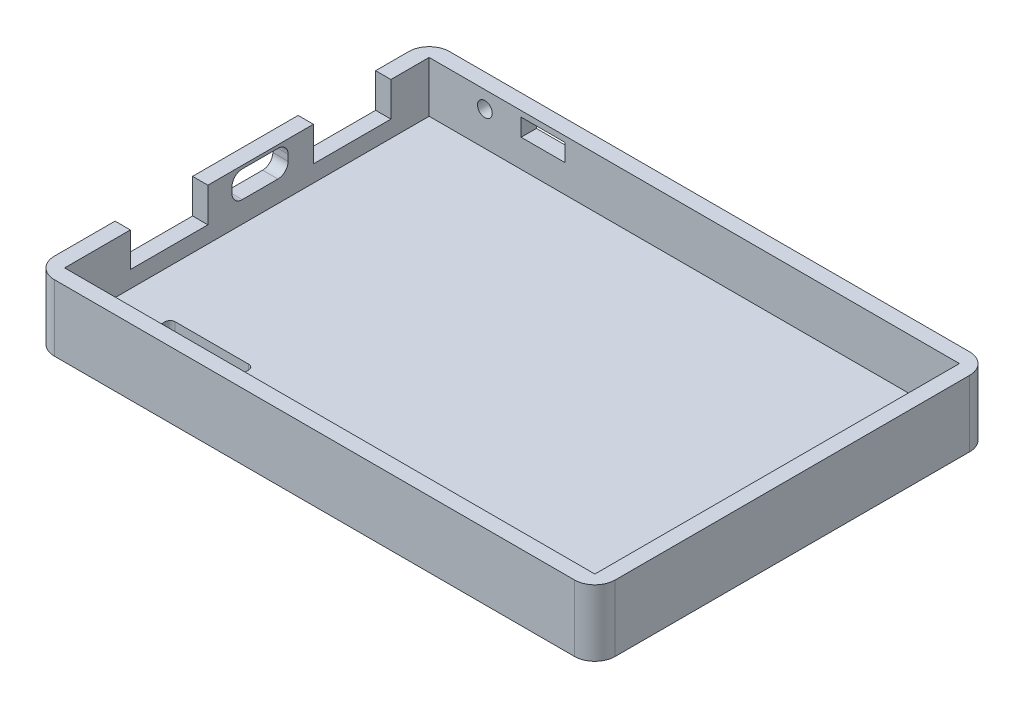
from build123d import *

# Parameters (mm, degrees)
SKETCH1_W               = 110
SKETCH1_H               = 77.5
SKETCH1_W_2             = 104
SKETCH1_H_2             = 71.5
BOSS_EXTRUDE1_DEPTH     = 10
SKETCH1_2_W             = 110
SKETCH1_2_H             = 77.5
BOSS_EXTRUDE2_DEPTH     = 3
CUT_EXTRUDE1_REACH      = 136.931
SKETCH3_W               = 15.2
SKETCH3_H               = 6.73
CUT_EXTRUDE2_REACH      = 136.931
SKETCH4_R               = 1.45
SKETCH4_W               = 8.6
SKETCH4_H               = 3.42
CUT_EXTRUDE3_DEPTH      = 135.930537685
CUT_EXTRUDE3_DEPTH_BACK = 135.930537685
SKETCH5_W               = 16.4
SKETCH5_H               = 5
FILLET1_R               = 4
FILLET2_R               = 1


with BuildPart() as part:
    # Sketch1 → Boss-Extrude1 (new body)
    with BuildSketch(Plane(origin=(0, 0, 0), x_dir=(1, 0, 0), z_dir=(0, 1, 0))):
        with Locations((55, 38.75)):
            Rectangle(SKETCH1_W, SKETCH1_H)
        with Locations((55, 38.75)):
            Rectangle(SKETCH1_W_2, SKETCH1_H_2, mode=Mode.SUBTRACT)
    extrude(amount=BOSS_EXTRUDE1_DEPTH)

    # Sketch1<2> → Boss-Extrude2 (add)
    with BuildSketch(Plane(origin=(0, 0, 0), x_dir=(1, 0, 0), z_dir=(0, 1, 0))):
        with Locations((55, 38.75)):
            Rectangle(SKETCH1_2_W, SKETCH1_2_H)
    extrude(amount=-BOSS_EXTRUDE2_DEPTH)

    # Sketch3 → Cut-Extrude1 (cut, up to next)
    with BuildSketch(Plane.ZY, mode=Mode.PRIVATE) as cut_extrude1_sk1:
        with Locations((-23.5, 6.635)):
            Rectangle(SKETCH3_W, SKETCH3_H)
    cut_extrude1_tool1 = extrude(cut_extrude1_sk1.sketch, amount=-CUT_EXTRUDE1_REACH, mode=Mode.PRIVATE) & part.part
    # Sketch3 → Cut-Extrude1 (cut, up to next)
    with BuildSketch(Plane.ZY, mode=Mode.PRIVATE) as cut_extrude1_sk2:
        with Locations((-59.4, 6.635)):
            Rectangle(SKETCH3_W, SKETCH3_H)
    cut_extrude1_tool2 = extrude(cut_extrude1_sk2.sketch, amount=-CUT_EXTRUDE1_REACH, mode=Mode.PRIVATE) & part.part
    # Sketch3 → Cut-Extrude1 (cut, up to next)
    with BuildSketch(Plane.ZY, mode=Mode.PRIVATE) as cut_extrude1_sk3:
        with BuildLine():
            Line((-37.84, 9.38), (-44.840000134, 9.38))
            ThreePointArc((-44.840000134, 9.38), (-46.254213696, 8.794213562), (-46.840000134, 7.38))
            Line((-46.840000134, 7.38), (-46.840000134, 6.18))
            ThreePointArc((-46.840000134, 6.18), (-46.254213696, 4.765786438), (-44.840000134, 4.18))
            Line((-44.840000134, 4.18), (-37.84, 4.18))
            ThreePointArc((-37.84, 4.18), (-36.425786438, 4.765786438), (-35.84, 6.18))
            Line((-35.84, 6.18), (-35.84, 7.38))
            ThreePointArc((-35.84, 7.38), (-36.425786438, 8.794213562), (-37.84, 9.38))
        make_face()
    cut_extrude1_tool3 = extrude(cut_extrude1_sk3.sketch, amount=-CUT_EXTRUDE1_REACH, mode=Mode.PRIVATE) & part.part
    add(cut_extrude1_tool1.solids().sort_by_distance((0, 6.635, -23.5))[0], mode=Mode.SUBTRACT)
    add(cut_extrude1_tool2.solids().sort_by_distance((0, 6.635, -59.4))[0], mode=Mode.SUBTRACT)
    add(cut_extrude1_tool3.solids().sort_by_distance((0, 6.78, -41.34))[0], mode=Mode.SUBTRACT)

    # Sketch4 → Cut-Extrude2 (cut, up to next)
    with BuildSketch(Plane(origin=(0, 0, -77.5), x_dir=(-1, 0, 0), z_dir=(0, 0, -1)), mode=Mode.PRIVATE) as cut_extrude2_sk1:
        with Locations((-13.93, 6.69)):
            Circle(SKETCH4_R)
    cut_extrude2_tool1 = extrude(cut_extrude2_sk1.sketch, amount=-CUT_EXTRUDE2_REACH, mode=Mode.PRIVATE) & part.part
    # Sketch4 → Cut-Extrude2 (cut, up to next)
    with BuildSketch(Plane(origin=(0, 0, -77.5), x_dir=(-1, 0, 0), z_dir=(0, 0, -1)), mode=Mode.PRIVATE) as cut_extrude2_sk2:
        with Locations((-25.34, 7.17)):
            Rectangle(SKETCH4_W, SKETCH4_H)
    cut_extrude2_tool2 = extrude(cut_extrude2_sk2.sketch, amount=-CUT_EXTRUDE2_REACH, mode=Mode.PRIVATE) & part.part
    add(cut_extrude2_tool1.solids().sort_by_distance((13.93, 6.69, -77.5))[0], mode=Mode.SUBTRACT)
    add(cut_extrude2_tool2.solids().sort_by_distance((25.34, 7.17, -77.5))[0], mode=Mode.SUBTRACT)

    # Sketch5 → Cut-Extrude3 (cut, two sides: drawn at the far end of the back side and taken through both)
    with BuildSketch(Plane(origin=(0, 0, 0), x_dir=(1, 0, 0), z_dir=(0, 1, 0)).offset(-CUT_EXTRUDE3_DEPTH_BACK)):
        with Locations((20.2, 12.2)):
            Rectangle(SKETCH5_W, SKETCH5_H)
    extrude(amount=CUT_EXTRUDE3_DEPTH + CUT_EXTRUDE3_DEPTH_BACK, mode=Mode.SUBTRACT)

    # Fillet1
    fillet1_edges = [part.edges().sort_by_distance(p)[0] for p in [
        (110, 3.5, -77.5),
        (0, 3.5, -77.5),
        (110, 3.5, 0),
        (0, 3.5, 0),
    ]]
    fillet(fillet1_edges, radius=FILLET1_R)

    # Fillet2
    fillet2_edges = [part.edges().sort_by_distance(p)[0] for p in [
        (28.4, -1.5, -14.7),
        (28.4, -1.5, -9.7),
        (12, -1.5, -9.7),
        (12, -1.5, -14.7),
    ]]
    fillet(fillet2_edges, radius=FILLET2_R)


solid = part.part
